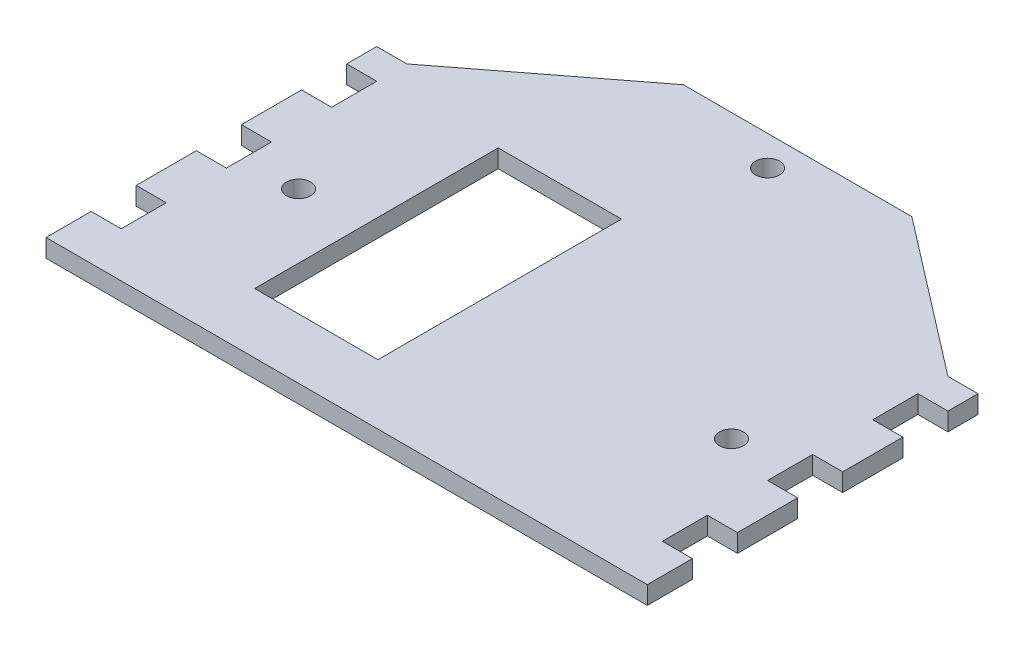
from build123d import *

# Parameters (mm, degrees)
SKETCH1_R           = 2
SKETCH1_W           = 20.5
SKETCH1_H           = 40.5
BOSS_EXTRUDE1_DEPTH = 3


with BuildPart() as part:
    # Sketch1 → Boss-Extrude1 (new body)
    with BuildSketch(Plane(origin=(0, 0, 0), x_dir=(1, 0, 0), z_dir=(0, 1, 0))):
        Polygon((-45, 10), (-45, 2.5), (-50, 2.5), (-50, -7.5), (-45, -7.5), (-45, -15), (-50, -15), (-50, -25), (-45, -25), (-45, -32.5), (-50, -32.5), (-50, -40), (50, -40), (50, -32.5), (45, -32.5), (45, -25), (50, -25), (50, -15), (45, -15), (45, -7.5), (50, -7.5), (50, 2.5), (45, 2.5), (45, 10), (50, 10), (50, 15), (45, 15), (19, 35), (-19, 35), (-45, 15), (-50, 15), (-50, 10), align=None)
        with Locations(Location((0, 30, 0), (0, 0, 270))):
            Circle(SKETCH1_R, mode=Mode.SUBTRACT)
        with Locations(Location((-36, -12, 0), (0, 0, 270))):
            Circle(SKETCH1_R, mode=Mode.SUBTRACT)
        with Locations(Location((36, -12, 0), (0, 0, 270))):
            Circle(SKETCH1_R, mode=Mode.SUBTRACT)
        with Locations((-15.05, -9.75)):
            Rectangle(SKETCH1_W, SKETCH1_H, mode=Mode.SUBTRACT)
    extrude(amount=BOSS_EXTRUDE1_DEPTH)


solid = part.part
